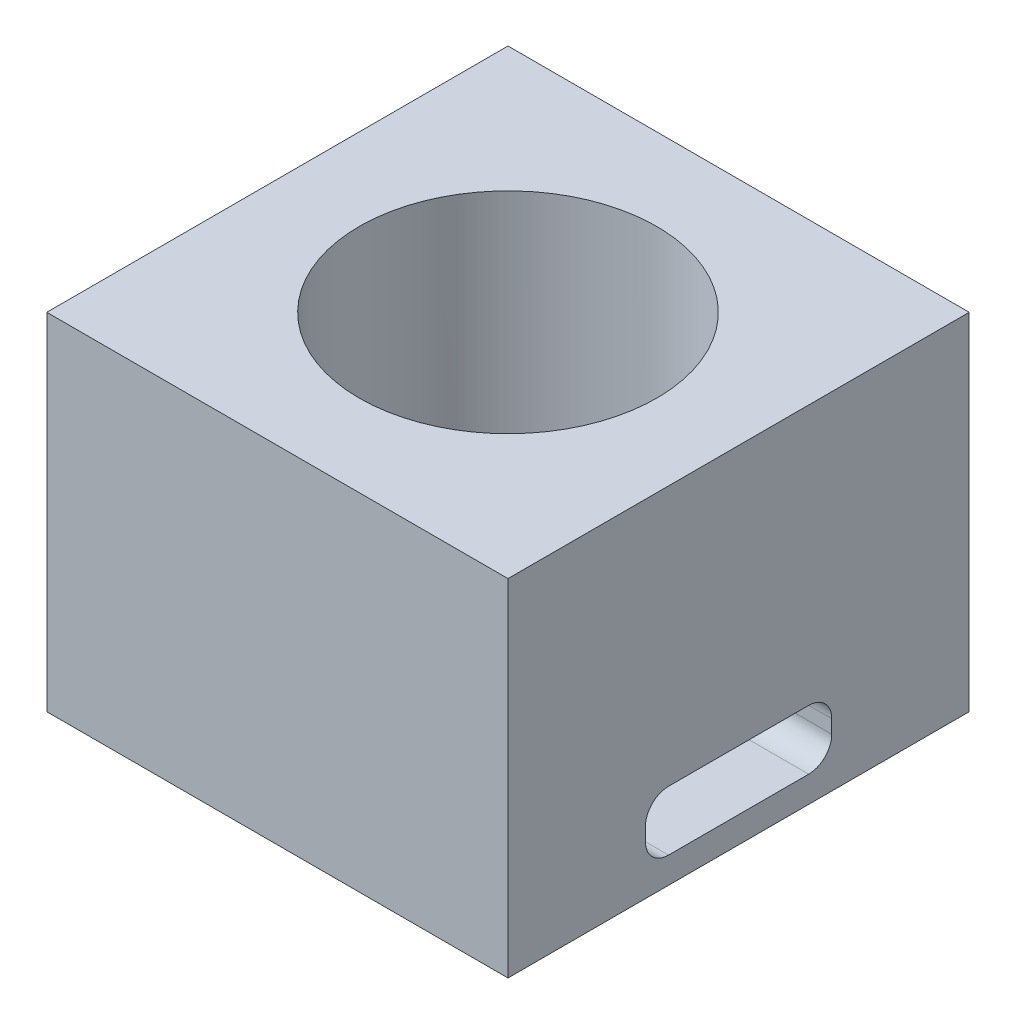
from build123d import *

# Parameters (mm, degrees)
SKETCH1_W           = 50.8
SKETCH1_H           = 50.8
BOSS_EXTRUDE1_DEPTH = 38.1
SKETCH2_R           = 16.383
CUT_EXTRUDE1_DEPTH  = 49.53
CUT_EXTRUDE2_DEPTH  = 29.21


with BuildPart() as part:
    # Sketch1 → Boss-Extrude1 (new body)
    with BuildSketch(Plane(origin=(0, 0, 0), x_dir=(1, 0, 0), z_dir=(0, 1, 0))):
        Rectangle(SKETCH1_W, SKETCH1_H)
    extrude(amount=BOSS_EXTRUDE1_DEPTH)

    # Sketch2 → Cut-Extrude1 (cut)
    with BuildSketch(Plane(origin=(0, 38.1, 0), x_dir=(1, 0, 0), z_dir=(0, 1, 0))):
        with Locations(Location((0, 0, 0), (0, 0, 270))):
            Circle(SKETCH2_R)
    extrude(amount=-CUT_EXTRUDE1_DEPTH, mode=Mode.SUBTRACT)

    # Sketch3 → Cut-Extrude2 (cut)
    with BuildSketch(Plane(origin=(25.4, 0, 0), x_dir=(0, 0, -1), z_dir=(1, 0, 0))):
        with BuildLine():
            Line((-7.718095527, 9.445615075), (7.718095527, 9.445615075))
            ThreePointArc((7.718095527, 9.445615075), (9.514146751, 8.701666299), (10.258095527, 6.905615075))
            Line((10.258095527, 6.905615075), (10.258095527, 5.424599661))
            ThreePointArc((10.258095527, 5.424599661), (9.514146751, 3.628548437), (7.718095527, 2.884599661))
            Line((7.718095527, 2.884599661), (-7.718095527, 2.884599661))
            ThreePointArc((-7.718095527, 2.884599661), (-9.514146751, 3.628548437), (-10.258095527, 5.424599661))
            Line((-10.258095527, 5.424599661), (-10.258095527, 6.905615075))
            ThreePointArc((-10.258095527, 6.905615075), (-9.514146751, 8.701666299), (-7.718095527, 9.445615075))
        make_face()
    extrude(amount=-CUT_EXTRUDE2_DEPTH, mode=Mode.SUBTRACT)


solid = part.part
